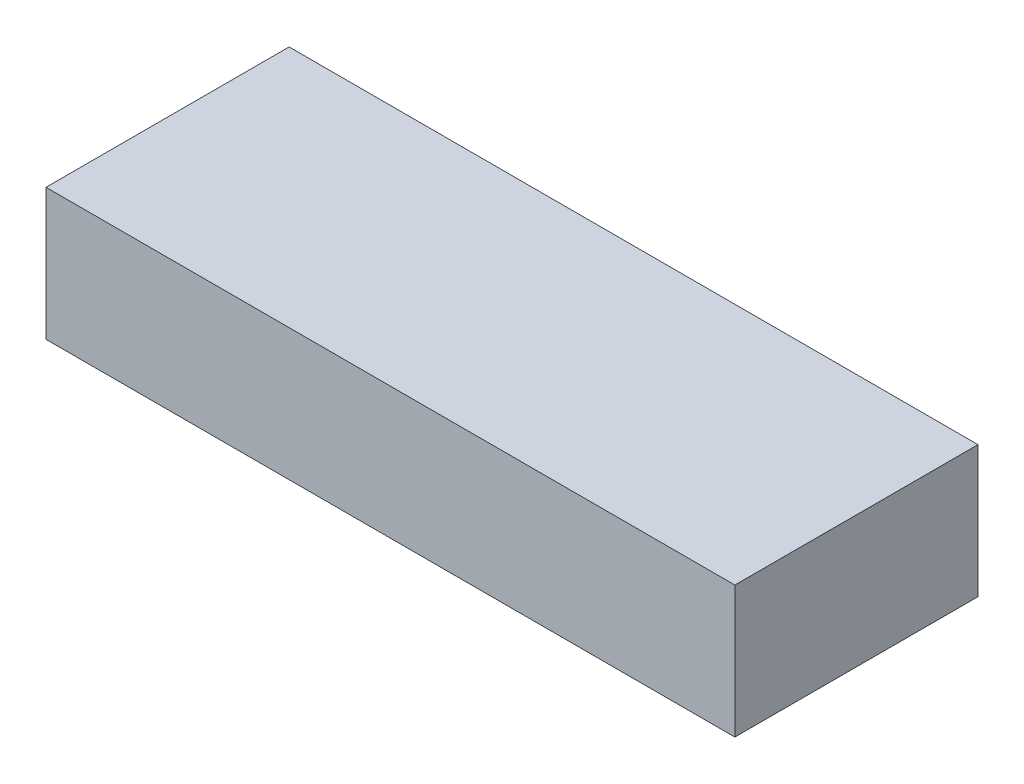
from build123d import *

# Parameters (mm, degrees)
SKETCH1_W           = 30.48
SKETCH1_H           = 16.51
BOSS_EXTRUDE1_DEPTH = 86.36


with BuildPart() as part:
    # Sketch1 → Boss-Extrude1 (new body)
    with BuildSketch(Plane(origin=(0, 0, 0), x_dir=(0, 0, -1), z_dir=(1, 0, 0))):
        with Locations((15.24, 8.255)):
            Rectangle(SKETCH1_W, SKETCH1_H)
    extrude(amount=BOSS_EXTRUDE1_DEPTH)


solid = part.part
